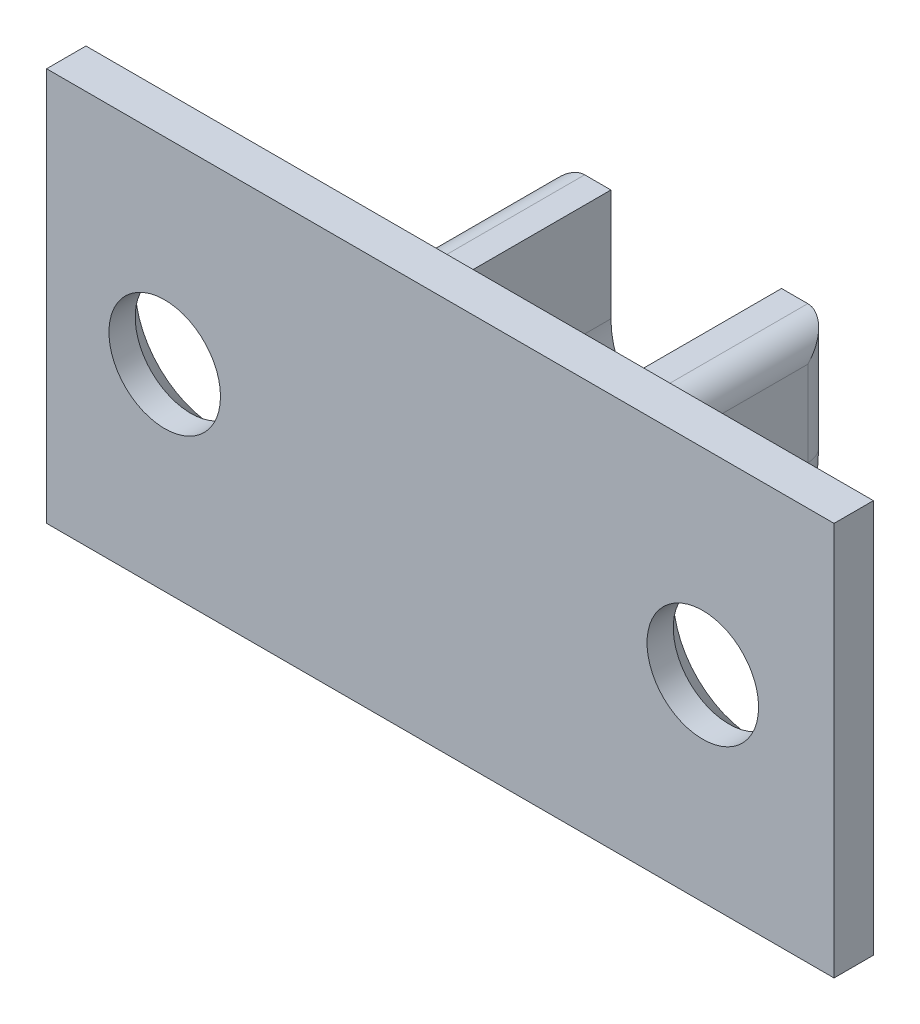
from build123d import *

# Parameters (mm, degrees)
ESQUISSE1_W        = 30.5
ESQUISSE1_H        = 15
ESQUISSE1_R        = 2.125
BOSS_EXTRU_3_DEPTH = 2
BOSS_EXTRU_4_DEPTH = 8
CONG_3_R           = 1
CHANFREIN2_SIZE    = 1
CHANFREIN3_SIZE    = 0.5


with BuildPart() as part:
    # Esquisse1 → Boss.-Extru.3 (new body)
    with BuildSketch(Plane.XY):
        with Locations((15.25, 7.5)):
            Rectangle(ESQUISSE1_W, ESQUISSE1_H)
        with Locations((5, 7.5)):
            Circle(ESQUISSE1_R, mode=Mode.SUBTRACT)
        with Locations((25.5, 7.5)):
            Circle(ESQUISSE1_R, mode=Mode.SUBTRACT)
    extrude(amount=BOSS_EXTRU_3_DEPTH)

    # Esquisse1<5> → Boss.-Extru.4 (add)
    with BuildSketch(Plane.XY):
        with BuildLine():
            ThreePointArc((18.5, 7.5), (15.25, 4.25), (12, 7.5))
            Line((12, 7.5), (12, 11.75))
            Line((12, 11.75), (10, 11.75))
            Line((10, 11.75), (10, 7.5))
            ThreePointArc((10, 7.5), (15.25, 2.25), (20.5, 7.5))
            Line((20.5, 7.5), (20.5, 11.75))
            Line((20.5, 11.75), (18.5, 11.75))
            Line((18.5, 11.75), (18.5, 7.5))
        make_face()
    extrude(amount=-BOSS_EXTRU_4_DEPTH)

    # Congé3
    cong_3_edges = [part.edges().sort_by_distance(p)[0] for p in [
        (20.5, 9.625, -8),
        (10, 9.625, -8),
        (20.5, 9.625, 0),
        (20.5, 11.75, -4),
        (10, 11.75, -4),
        (11, 11.75, 0),
        (19.5, 11.75, 0),
        (10, 9.625, 0),
        (15.25, 2.25, 0),
        (15.25, 2.25, -8),
    ]]
    fillet(cong_3_edges, radius=CONG_3_R)

    # Chanfrein2
    chanfrein2_edges = [part.edges().sort_by_distance(p)[0] for p in [
        (2.875, 7.5, 0),
        (23.375, 7.5, 0),
    ]]
    chamfer(chanfrein2_edges, length=CHANFREIN2_SIZE)

    # Chanfrein3
    chanfrein3_edges = [part.edges().sort_by_distance(p)[0] for p in [
        (0, 15, 1),
        (0, 7.5, 2),
        (0, 0, 1),
        (0, 7.5, 0),
        (15.25, 15, 0),
        (30.5, 7.5, 0),
        (15.25, 0, 0),
    ]]
    chamfer(chanfrein3_edges, length=CHANFREIN3_SIZE)


solid = part.part
